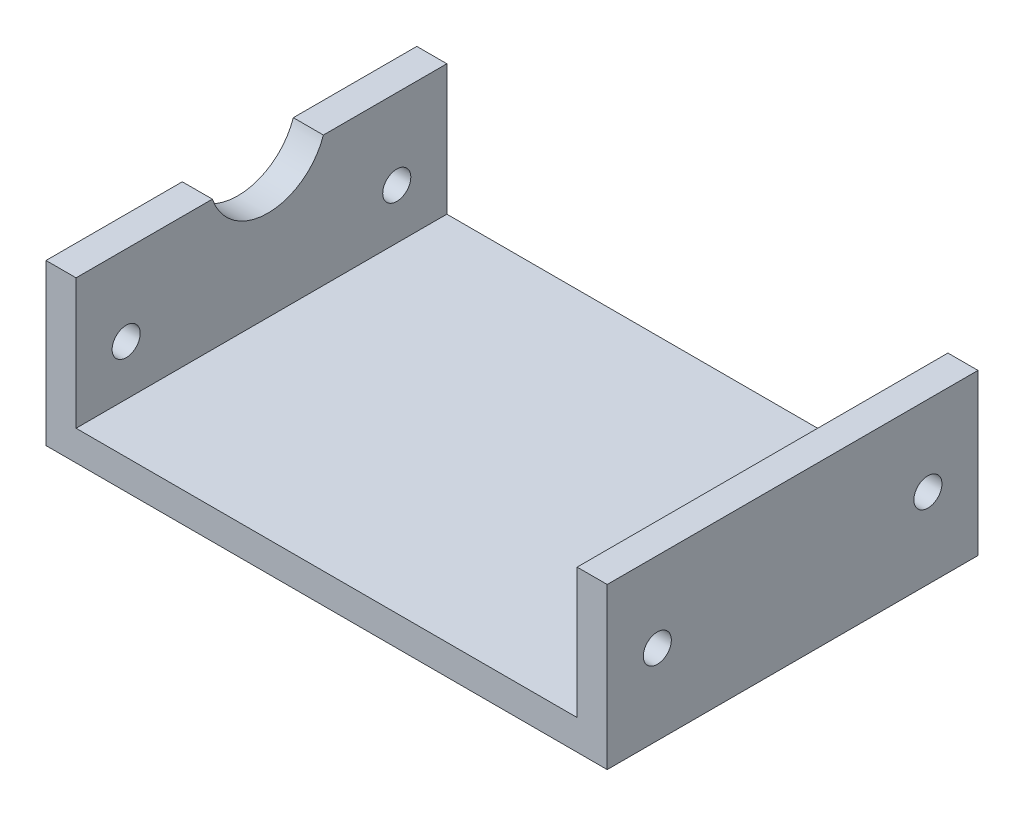
from build123d import *

# Parameters (mm, degrees)
ESBO_O1_W                = 56
ESBO_O1_H                = 37
RESSALTO_EXTRUS_O1_DEPTH = 3
ESBO_O10_W               = 3
ESBO_O10_H               = 37
RESSALTO_EXTRUS_O2_DEPTH = 13
ESBO_O13_W               = 3
ESBO_O13_H               = 37
RESSALTO_EXTRUS_O3_DEPTH = 13
ESBO_O14_R               = 5.84268935
CORTE_EXTRUS_O1_DEPTH    = 30
ESBO_O15_R               = 1.4
CORTE_EXTRUS_O2_DEPTH    = 60
ESBO_O17_R               = 1.4
CORTE_EXTRUS_O3_DEPTH    = 60


with BuildPart() as part:
    # Esboço1 → Ressalto-extrusão1 (new body)
    with BuildSketch(Plane(origin=(0, 0, 0), x_dir=(1, 0, 0), z_dir=(0, 1, 0))):
        with Locations((18.614655485, 40.673930531)):
            Rectangle(ESBO_O1_W, ESBO_O1_H)
    extrude(amount=RESSALTO_EXTRUS_O1_DEPTH)

    # Esboço10 → Ressalto-extrusão2 (add)
    with BuildSketch(Plane(origin=(0, 3, 0), x_dir=(1, 0, 0), z_dir=(0, 1, 0))):
        with Locations((-7.885344515, 40.673930531)):
            Rectangle(ESBO_O10_W, ESBO_O10_H)
    extrude(amount=RESSALTO_EXTRUS_O2_DEPTH)

    # Esboço13 → Ressalto-extrusão3 (add)
    with BuildSketch(Plane(origin=(0, 3, 0), x_dir=(1, 0, 0), z_dir=(0, 1, 0))):
        with Locations((45.114655485, 40.673930531)):
            Rectangle(ESBO_O13_W, ESBO_O13_H)
    extrude(amount=RESSALTO_EXTRUS_O3_DEPTH)

    # Esboço14 → Corte-extrusão1 (cut)
    with BuildSketch(Plane.ZY.offset(9.385344515)):
        with Locations((-41.314070298, 17.859240249)):
            Circle(ESBO_O14_R)
    extrude(amount=-CORTE_EXTRUS_O1_DEPTH, mode=Mode.SUBTRACT)

    # Esboço15 → Corte-extrusão2 (cut)
    with BuildSketch(Plane.ZY.offset(9.385344515)):
        with Locations((-27.173930531, 8)):
            Circle(ESBO_O15_R)
    extrude(amount=-CORTE_EXTRUS_O2_DEPTH, mode=Mode.SUBTRACT)

    # Esboço17 → Corte-extrusão3 (cut)
    with BuildSketch(Plane.ZY.offset(9.385344515)):
        with Locations((-54.173930531, 8)):
            Circle(ESBO_O17_R)
    extrude(amount=-CORTE_EXTRUS_O3_DEPTH, mode=Mode.SUBTRACT)


solid = part.part
